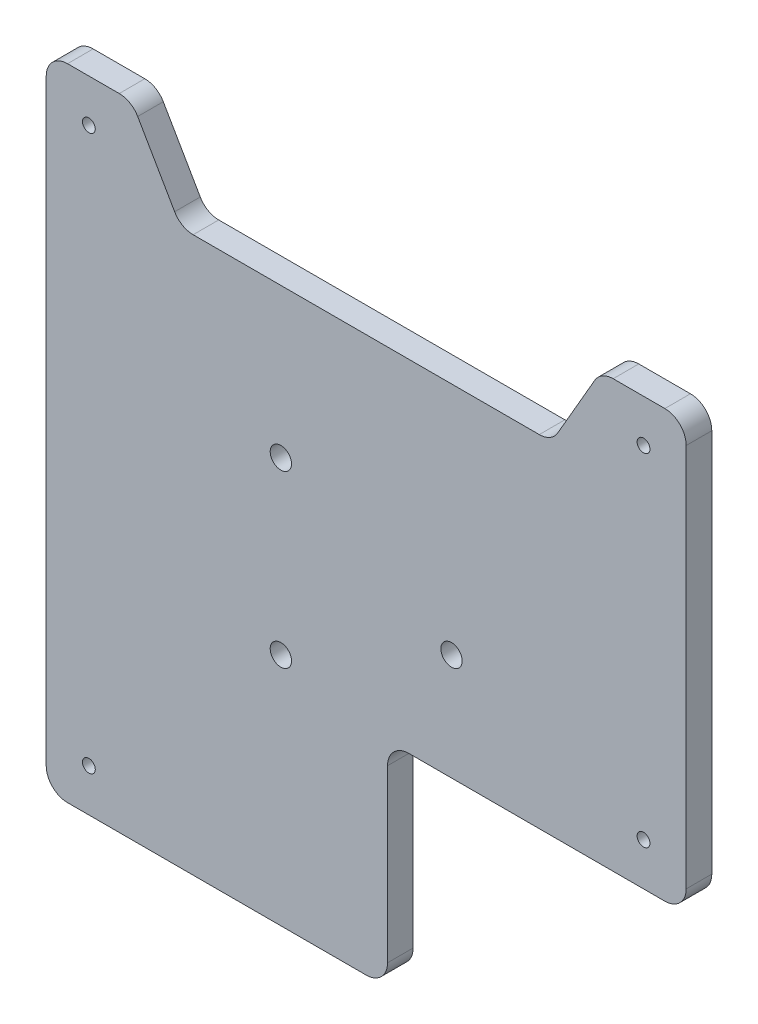
from build123d import *

# Parameters (mm, degrees)
ESBO_O1_W                = 150
ESBO_O1_H                = 150
ESBO_O1_R                = 2.5
RESSALTO_EXTRUS_O1_DEPTH = 6
CORTE_EXTRUS_O1_DEPTH    = 6
ESBO_O3_W                = 70
ESBO_O3_H                = 50
CORTE_EXTRUS_O2_DEPTH    = 6
FILETE1_R                = 5
ESBO_O4_R                = 1.5
CORTE_EXTRUS_O3_DEPTH    = 6


with BuildPart() as part:
    # Esboço1 → Ressalto-extrusão1 (new body)
    with BuildSketch(Plane.XY):
        with Locations((-63.750118326, 45.053956835)):
            Rectangle(ESBO_O1_W, ESBO_O1_H)
        with Locations((-83.750118326, 65.053956835)):
            Circle(ESBO_O1_R, mode=Mode.SUBTRACT)
        with Locations((-83.750118326, 25.053956835)):
            Circle(ESBO_O1_R, mode=Mode.SUBTRACT)
        with Locations((-43.750118326, 45.053956835)):
            Circle(ESBO_O1_R, mode=Mode.SUBTRACT)
    extrude(amount=RESSALTO_EXTRUS_O1_DEPTH)

    # Esboço2 → Corte-extrusão1 (cut)
    with BuildSketch(Plane.XY.offset(6)):
        Polygon((-8.750118326, 120.053956835), (-20.29712371, 100.053956835), (-107.203112943, 100.053956835), (-118.750118326, 120.053956835), align=None)
    extrude(amount=-CORTE_EXTRUS_O1_DEPTH, mode=Mode.SUBTRACT)

    # Esboço3 → Corte-extrusão2 (cut)
    with BuildSketch(Plane.XY.offset(6)):
        with Locations((-23.750118326, -4.946043165)):
            Rectangle(ESBO_O3_W, ESBO_O3_H)
    extrude(amount=-CORTE_EXTRUS_O2_DEPTH, mode=Mode.SUBTRACT)

    # Filete1
    filete1_edges = [part.edges().sort_by_distance(p)[0] for p in [
        (-20.29712371, 100.053956835, 3),
        (-107.203112943, 100.053956835, 3),
        (-118.750118326, 120.053956835, 3),
        (-8.750118326, 120.053956835, 3),
        (-58.750118326, -29.946043165, 3),
        (-58.750118326, 20.053956835, 3),
        (11.249881674, 20.053956835, 3),
        (-138.750118326, -29.946043165, 3),
        (-138.750118326, 120.053956835, 3),
        (11.249881674, 120.053956835, 3),
    ]]
    fillet(filete1_edges, radius=FILETE1_R)

    # Esboço4 → Corte-extrusão3 (cut)
    with BuildSketch(Plane.XY.offset(6)):
        with Locations((1.249881674, 110.053956835)):
            Circle(ESBO_O4_R)
        with Locations((1.249881674, 30.053956835)):
            Circle(ESBO_O4_R)
        with Locations((-128.750118326, 110.053956835)):
            Circle(ESBO_O4_R)
        with Locations((-128.750118326, -19.946043165)):
            Circle(ESBO_O4_R)
    extrude(amount=-CORTE_EXTRUS_O3_DEPTH, mode=Mode.SUBTRACT)


solid = part.part
